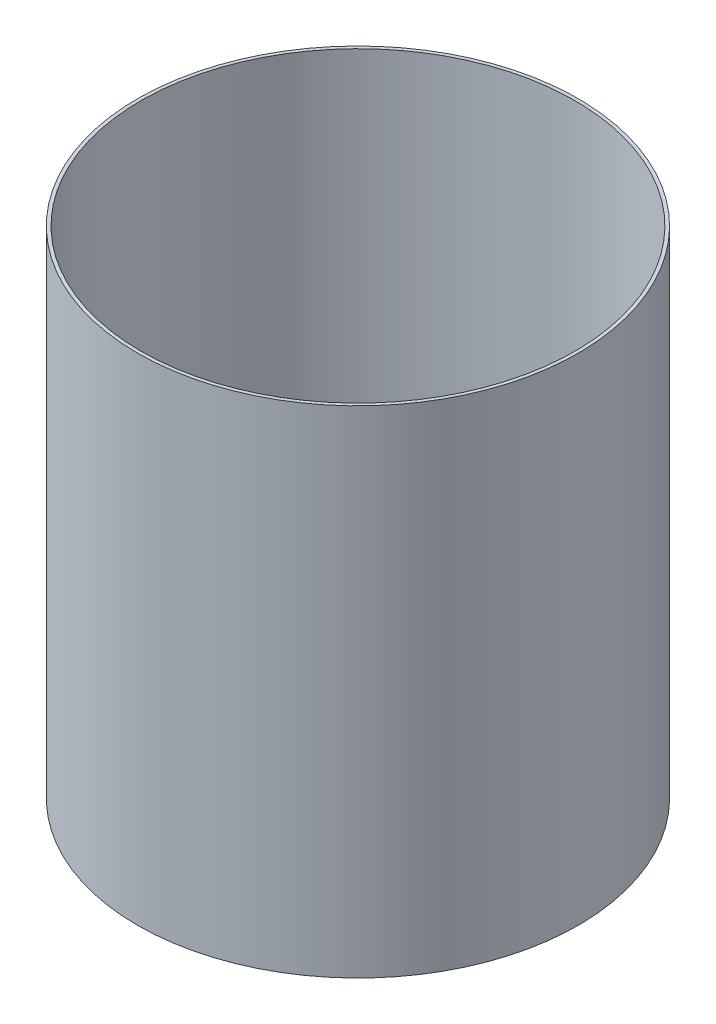
from build123d import *

# Parameters (mm, degrees)
SKETCH1_R           = 66.7
SKETCH1_R_2         = 65.7
BOSS_EXTRUDE1_DEPTH = 75


with BuildPart() as part:
    # Sketch1 → Boss-Extrude1 (new, symmetric)
    with BuildSketch(Plane(origin=(0, 0, 0), x_dir=(1, 0, 0), z_dir=(0, 1, 0))):
        with Locations(Location((0, 0, 0), (0, 0, 270))):
            Circle(SKETCH1_R)
        with Locations(Location((0, 0, 0), (0, 0, 270))):
            Circle(SKETCH1_R_2, mode=Mode.SUBTRACT)
    extrude(amount=BOSS_EXTRUDE1_DEPTH, both=True)


solid = part.part
